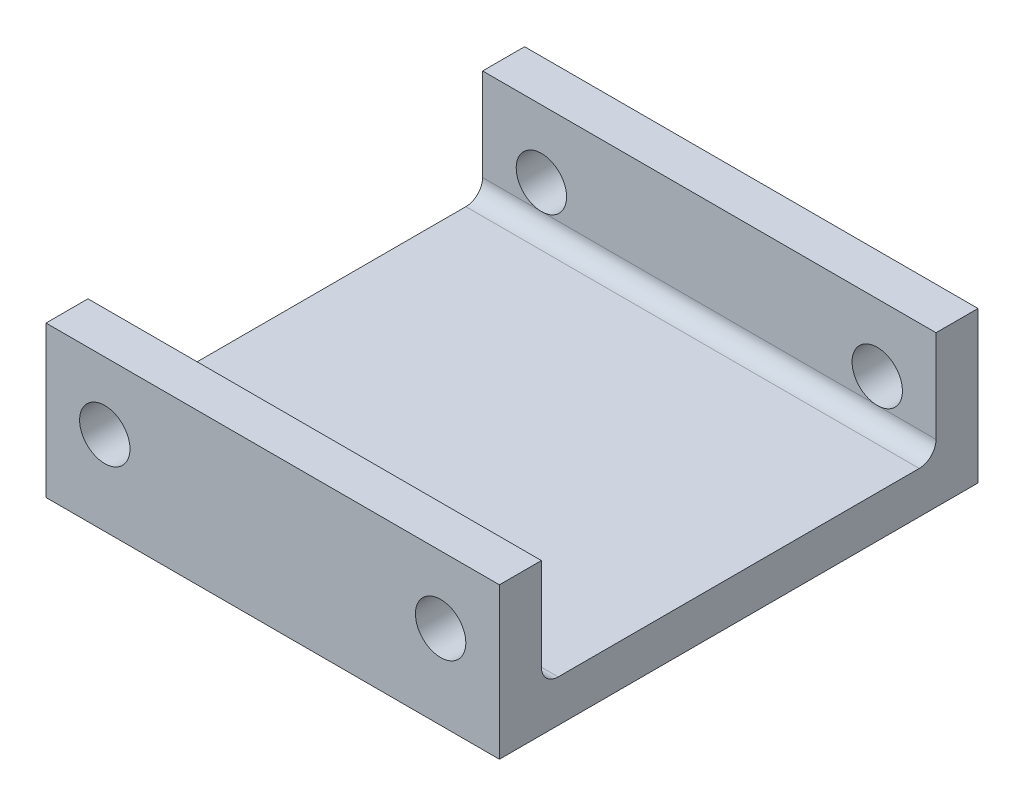
from build123d import *

# Parameters (mm, degrees)
ESQUISSE1_W             = 54
ESQUISSE1_H             = 18
ESQUISSE1_R             = 3
BOSS_EXTRU_1_DEPTH      = 57
ENL_V_MAT_EXTRU_1_DEPTH = 57


with BuildPart() as part:
    # Esquisse1 → Boss.-Extru.1 (new body)
    with BuildSketch(Plane.XY):
        with Locations((0, -9)):
            Rectangle(ESQUISSE1_W, ESQUISSE1_H)
        with Locations(Location((-20, -8, 0), (0, 0, 180))):
            Circle(ESQUISSE1_R, mode=Mode.SUBTRACT)
        with Locations(Location((20, -8, 0), (0, 0, 180))):
            Circle(ESQUISSE1_R, mode=Mode.SUBTRACT)
    extrude(amount=BOSS_EXTRU_1_DEPTH)

    # Esquisse3 → Enlèv. mat.-Extru.1 (cut)
    with BuildSketch(Plane.ZY.offset(27)):
        with BuildLine():
            Line((52, 0), (5, 0))
            Line((5, 0), (5, -11))
            ThreePointArc((5, -11), (5.585786438, -12.414213562), (7, -13))
            Line((7, -13), (50, -13))
            ThreePointArc((50, -13), (51.414213562, -12.414213562), (52, -11))
            Line((52, -11), (52, 0))
        make_face()
    extrude(amount=-ENL_V_MAT_EXTRU_1_DEPTH, mode=Mode.SUBTRACT)


solid = part.part
